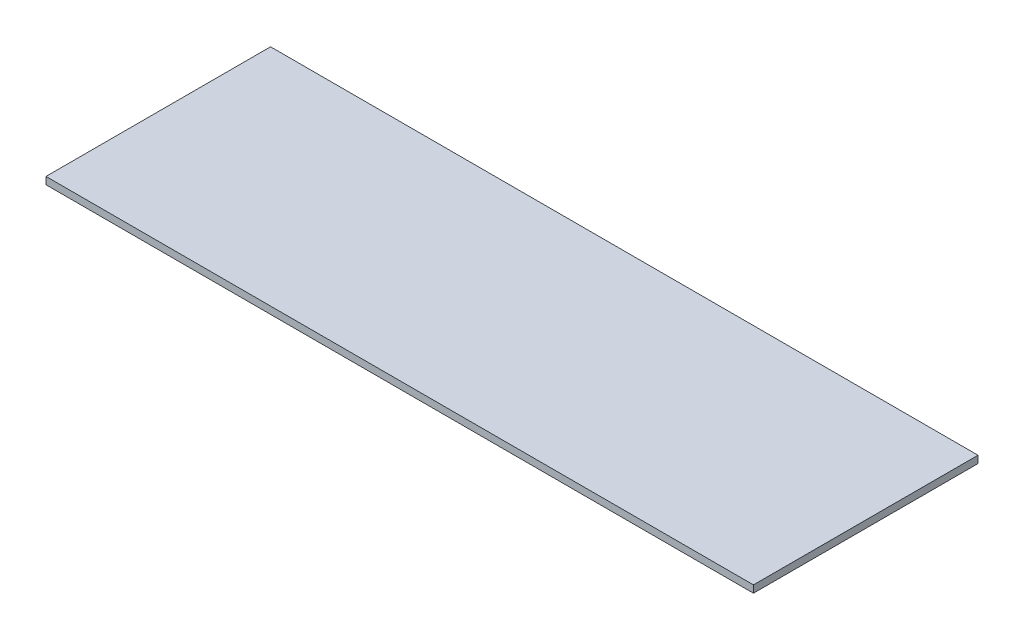
from build123d import *

# Parameters (mm, degrees)
SKETCH1_W           = 293
SKETCH1_H           = 93
BOSS_EXTRUDE1_DEPTH = 3


with BuildPart() as part:
    # Sketch1 → Boss-Extrude1 (new body)
    with BuildSketch(Plane(origin=(0, 0, 0), x_dir=(1, 0, 0), z_dir=(0, 1, 0))):
        with Locations((146.5, 46.5)):
            Rectangle(SKETCH1_W, SKETCH1_H)
    extrude(amount=BOSS_EXTRUDE1_DEPTH)


solid = part.part
